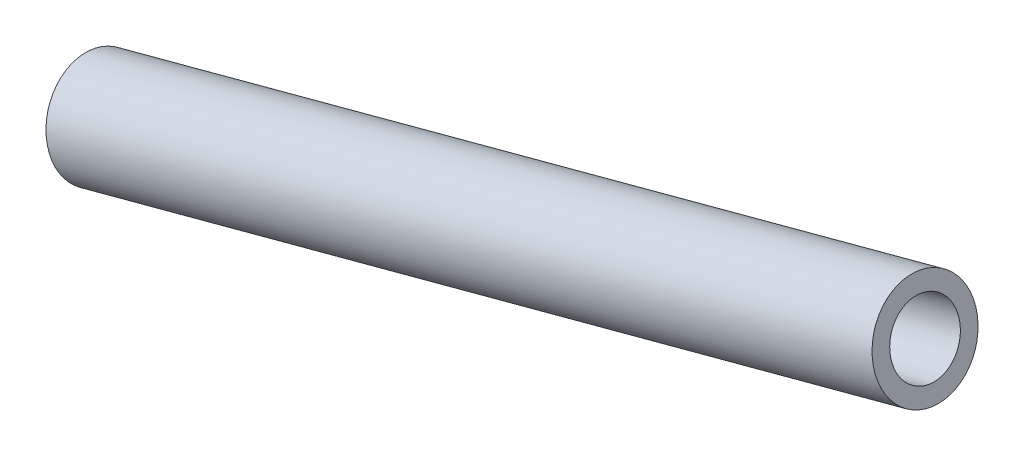
from build123d import *

# Parameters (mm, degrees)
SKETCH1_R           = 3
SKETCH1_R_2         = 2
BOSS_EXTRUDE1_DEPTH = 50


with BuildPart() as part:
    # Sketch1 → Boss-Extrude1 (new body)
    with BuildSketch(Plane(origin=(-33.099521562, -8.868990072, 0), x_dir=(0, 0, 1), z_dir=(-0.9659258262890696, -0.258819045102516, 0))):
        with Locations(Location((56.577866046, -28.0920161, 0), (0, 0, 270))):
            Circle(SKETCH1_R)
        with Locations(Location((56.577866046, -28.0920161, 0), (0, 0, 270))):
            Circle(SKETCH1_R_2, mode=Mode.SUBTRACT)
    extrude(amount=BOSS_EXTRUDE1_DEPTH)


solid = part.part
